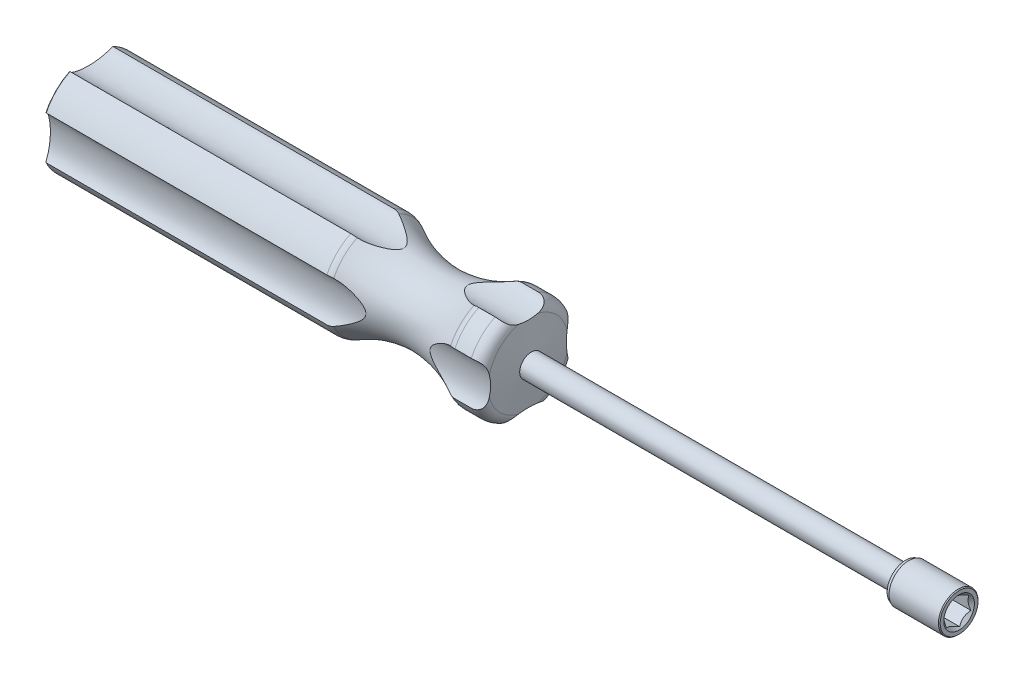
from build123d import *
from OCP.BRepFilletAPI import BRepFilletAPI_MakeChamfer

# Parameters (mm, degrees)
CUT_EXTRUDE4_DEPTH = 14
SKETCH5_R          = 0.53922581
CUT_EXTRUDE3_DEPTH = 24
FILLET1_R          = 4
SKETCH4_RX         = 7.657958065
SKETCH4_RY         = 3.350356654
CUT_EXTRUDE2_DEPTH = 175
CIRPATTERN2_COUNT  = 4
CHAMFER1_SIZE      = 0.5
CHAMFER1_SIZE2     = 0.930192011
CHAMFER2_SIZE      = 0.3


with BuildPart() as part:
    # Sketch1 → Revolve1 (revolve)
    with BuildSketch(Plane.XY, mode=Mode.PRIVATE) as revolve1_sk:
        Polygon((0, 0), (113.715967703, 0), (121.186821436, 0), (133.210033566, 0), (133.210033566, 6.839276945), (114.901390575, 6.839276945), (113.715967703, 4), (0, 4), (-66.928577077, 4), (-66.928577077, 0), align=None)
    revolve(revolve1_sk.sketch.rotate(Axis((0, 0, 0), (-1, 0, 0)), 90), axis=Axis((0, 0, 0), (-1, 0, 0)))

    # Sketch6 → Cut-Extrude4 (cut)
    with BuildSketch(Plane(origin=(133.210033566, 0, 0), x_dir=(0, 0, -1), z_dir=(1, 0, 0))):
        Polygon((3.860922707, 2.963070929), (-0.635633344, 4.825192611), (-4.496556051, 1.862121682), (-3.860922707, -2.963070929), (0.635633344, -4.825192611), (4.496556051, -1.862121682), align=None)
    extrude(amount=-CUT_EXTRUDE4_DEPTH, mode=Mode.SUBTRACT)

    # Cut-Extrude5 cone 1 section (through the dimple's axis) → Cut-Extrude5 (revolve, cut)
    with BuildSketch(Plane(origin=(133.210033566, 0, 0), x_dir=(0, 0, -1), z_dir=(0, 1, 0))):
        Polygon((0, 0), (5.303102816, 0), (0, 5.121146861), align=None)
    revolve(axis=Axis((133.210033566, 0, 0), (-1, 0, 0)), mode=Mode.SUBTRACT)

    # Sketch5 → Cut-Extrude3 (cut)
    with BuildSketch(Plane.ZY.offset(66.928577077)):
        with Locations((-3.5736542, -1.796940639)):
            Circle(SKETCH5_R)
        with Locations((-3.343023342, 2.196405002)):
            Circle(SKETCH5_R)
        with Locations((0.230630858, 3.993345641)):
            Circle(SKETCH5_R)
        with Locations((3.5736542, 1.796940639)):
            Circle(SKETCH5_R)
        with Locations((3.343023342, -2.196405002)):
            Circle(SKETCH5_R)
        with Locations((-0.230630858, -3.993345641)):
            Circle(SKETCH5_R)
    extrude(amount=-CUT_EXTRUDE3_DEPTH, mode=Mode.SUBTRACT)

    # Chamfer1: one chamfer whose edges measure the first distance from different faces: ONE call of the kernel's chamfer builder (chamfer() names one face for all edges)
    chamfer1_edges_1 = [part.edges().sort_by_distance(p)[0] for p in [
        (113.715967703, 0, 4),
    ]]
    chamfer1_side_1 = [part.faces().sort_by_distance(p)[0] for p in [
        (23.393695313, 0, 4),
    ]]
    chamfer1_edges_2 = [part.edges().sort_by_distance(p)[0] for p in [
        (114.901390575, 0, 6.839276945),
    ]]
    chamfer1_side_2 = [part.faces().sort_by_distance(p)[0] for p in [
        (114.308679139, 0, 5.419638472),
    ]]
    chamfer1 = BRepFilletAPI_MakeChamfer(part.part.solid().wrapped)
    for e in chamfer1_edges_1:
        chamfer1.Add(CHAMFER1_SIZE, CHAMFER1_SIZE2, e.wrapped, chamfer1_side_1[0].wrapped)  # the first distance lies on this face
    for e in chamfer1_edges_2:
        chamfer1.Add(CHAMFER1_SIZE, CHAMFER1_SIZE2, e.wrapped, chamfer1_side_2[0].wrapped)  # the first distance lies on this face
    add(Compound.cast(chamfer1.Shape()), mode=Mode.REPLACE)

    # Chamfer2
    chamfer2_edges = [part.edges().sort_by_distance(p)[0] for p in [
        (133.210033566, 0, 6.839276945),
    ]]
    chamfer(chamfer2_edges, length=CHAMFER2_SIZE)


with BuildPart() as body_2:
    # Sketch3 → Revolve2 (revolve)
    with BuildSketch(Plane.XY, mode=Mode.PRIVATE) as revolve2_sk:
        with BuildLine():
            Line((-14.704877313, 4), (-66.928577077, 4))
            Line((-66.928577077, 4), (-66.928577077, 0))
            Line((-66.928577077, 0), (-168.510801794, 0))
            add(Edge.make_bspline(
                [(-166.661414618, 17.403092786), (-168.510801794, 17.403092786), (-168.510801794, 0)],
                knots=[0, 0, 0, 1.570796327, 1.570796327, 1.570796327], degree=2, weights=[1, 0.707106781, 1]))
            Line((-166.661414618, 17.403092786), (-68.590046709, 17.403092786))
            add(Edge.make_bspline(
                [(-68.590046709, 17.403092786), (-62.879268217, 14.10053517), (-49.03627588, 9.486905272), (-34.823354616, 12.789462889), (-26.414275334, 17.403092786)],
                knots=[0.086154093, 0.086154093, 0.086154093, 0.086154093, 0.431459191, 0.913845907, 0.913845907, 0.913845907, 0.913845907], degree=3))
            Line((-26.414275334, 17.403092786), (-16.142141955, 17.403092786))
            Line((-16.142141955, 17.403092786), (-14.704877313, 4))
        make_face()
    revolve(revolve2_sk.sketch.rotate(Axis((-66.928577077, 0, 0), (-1, 0, 0)), 90), axis=Axis((-66.928577077, 0, 0), (-1, 0, 0)))

    # Fillet1
    fillet1_edges = [body_2.edges().sort_by_distance(p)[0] for p in [
        (-68.590046709, 0, 17.403092786),
        (-26.414275334, 0, 17.403092786),
        (-16.142141955, 0, 17.403092786),
    ]]
    fillet(fillet1_edges, radius=FILLET1_R)

    # Sketch4 → Cut-Extrude2 (cut)
    with BuildSketch(Plane(origin=(0, 0, 0), x_dir=(0, 0, -1), z_dir=(1, 0, 0))):
        with Locations((0, 16.452644281)):
            Ellipse(SKETCH4_RX, SKETCH4_RY)
    cut_extrude2 = extrude(amount=-CUT_EXTRUDE2_DEPTH, mode=Mode.SUBTRACT)

    # CirPattern2: Cut-Extrude2 ×4 about axis
    cirpattern2_axis = Axis((-14.704877313, 0, 0), (1, 0, 0))
    for i in range(1, CIRPATTERN2_COUNT):
        add(cut_extrude2.rotate(cirpattern2_axis, i * 360 / CIRPATTERN2_COUNT), mode=Mode.SUBTRACT)


solid = Compound([part.part, body_2.part])
